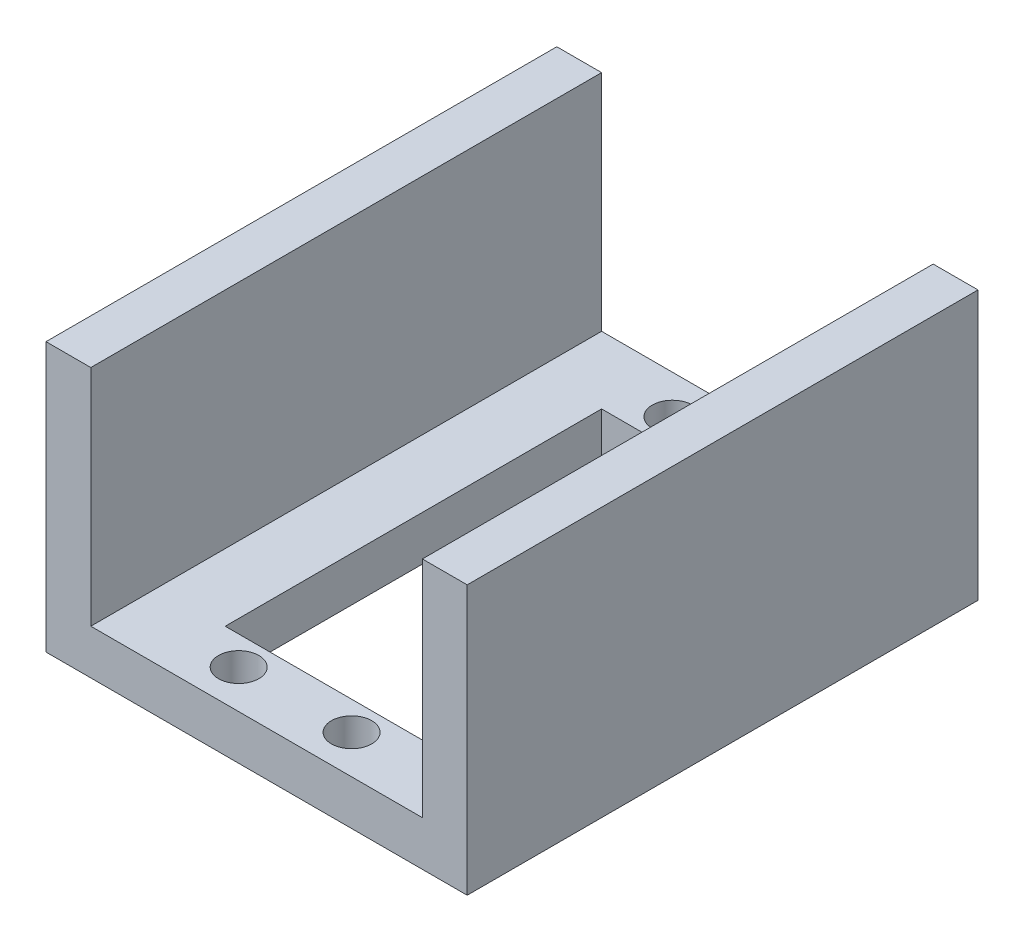
from build123d import *

# Parameters (mm, degrees)
SKETCH1_W            = 37
SKETCH1_H            = 57
SKETCH1_W_2          = 22
SKETCH1_H_2          = 42
BOSS_EXTRUDE1_DEPTH  = 5
M4_CLEARANCE_HOLE1_D = 4.5
SKETCH4_W            = 5
SKETCH4_H            = 57
BOSS_EXTRUDE2_DEPTH  = 30


with BuildPart() as part:
    # Sketch1 → Boss-Extrude1 (new body)
    with BuildSketch(Plane(origin=(0, 0, 0), x_dir=(1, 0, 0), z_dir=(0, 1, 0))):
        Rectangle(SKETCH1_W, SKETCH1_H)
        Rectangle(SKETCH1_W_2, SKETCH1_H_2, mode=Mode.SUBTRACT)
    extrude(amount=BOSS_EXTRUDE1_DEPTH)

    # M4 Clearance Hole1 (through all)
    with Locations(Plane(origin=(0, 5, 0), x_dir=(1, 0, 0), z_dir=(0, 1, 0))):
        with Locations((-6.3, 24.2), (6.3, 24.2), (-6.3, -24.2), (6.3, -24.2)):
            Hole(M4_CLEARANCE_HOLE1_D / 2)

    # Sketch4 → Boss-Extrude2 (add)
    with BuildSketch(Plane(origin=(0, 0, 0), x_dir=(1, 0, 0), z_dir=(0, 1, 0))):
        with Locations((-21, 0)):
            Rectangle(SKETCH4_W, SKETCH4_H)
        with Locations((21, 0)):
            Rectangle(SKETCH4_W, SKETCH4_H)
    extrude(amount=BOSS_EXTRUDE2_DEPTH)


solid = part.part
